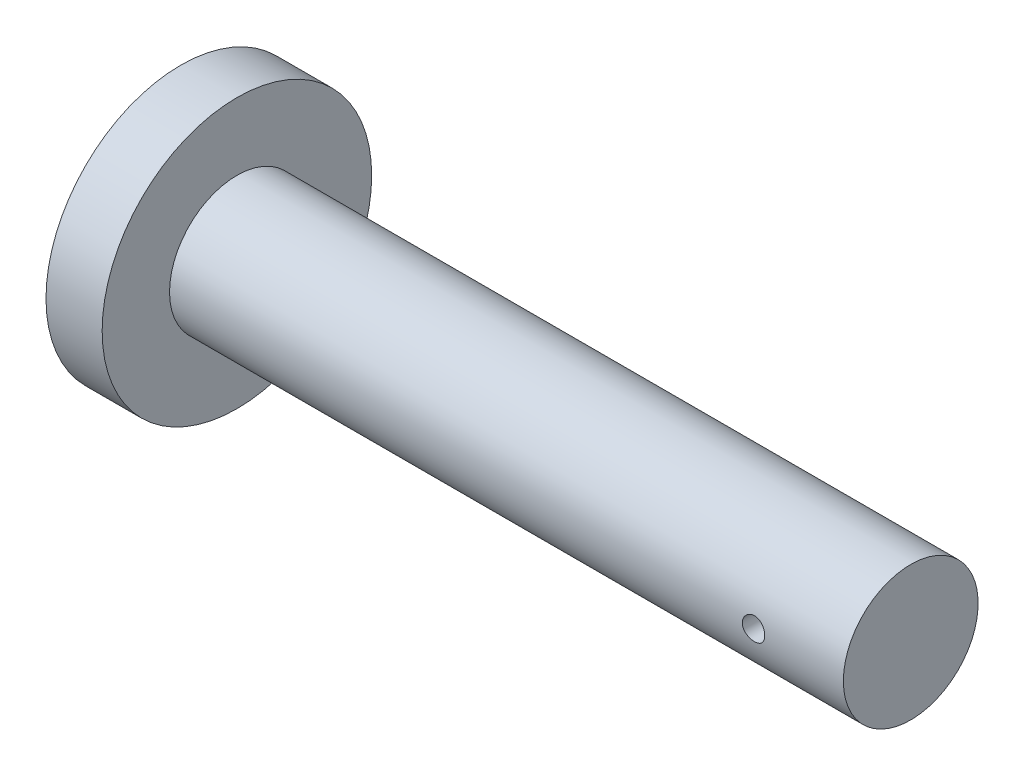
from build123d import *

# Parameters (mm, degrees)
CUT_EXTRUDE1_DEPTH      = 41.719067424
CUT_EXTRUDE1_DEPTH_BACK = 41.719067424
SKETCH2_R               = 1


with BuildPart() as part:
    # Sketch1 → Revolve1 (revolve)
    with BuildSketch(Plane.XY, mode=Mode.PRIVATE) as revolve1_sk:
        Polygon((-27.985915493, 12), (-27.985915493, 0), (37.014084507, 0), (37.014084507, 6), (-22.985915493, 6), (-22.985915493, 12), align=None)
    revolve(revolve1_sk.sketch.rotate(Axis((0, 0, 0), (1, 0, 0)), 90), axis=Axis((0, 0, 0), (1, 0, 0)))

    # Sketch2 → Cut-Extrude1 (cut, two sides: drawn at the far end of the back side and taken through both)
    with BuildSketch(Plane.XY.offset(-CUT_EXTRUDE1_DEPTH_BACK)):
        with Locations((29.014084507, 0)):
            Circle(SKETCH2_R)
    extrude(amount=CUT_EXTRUDE1_DEPTH + CUT_EXTRUDE1_DEPTH_BACK, mode=Mode.SUBTRACT)


solid = part.part
